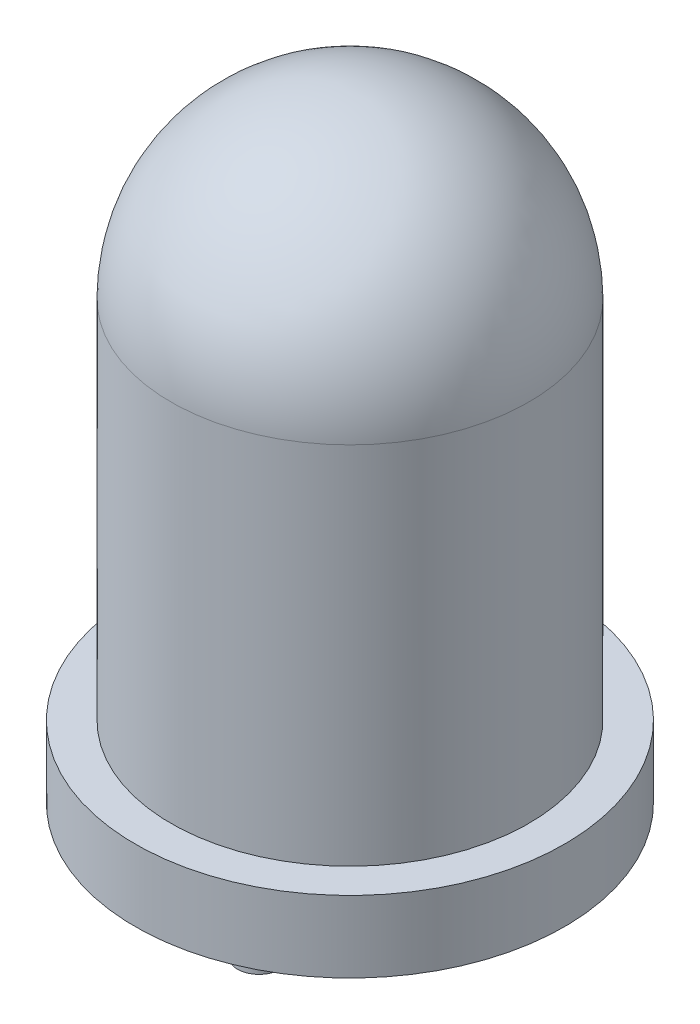
from build123d import *

# Parameters (mm, degrees)
ESQUISSE2_R        = 0.3
BOSS_EXTRU_1_DEPTH = 2.5
ESQUISSE3_R        = 0.3
BOSS_EXTRU_2_DEPTH = 1
BOSS_EXTRU_3_DEPTH = 0.25
ESQUISSE5_R        = 0.6
BOSS_EXTRU_4_DEPTH = 0.2


with BuildPart() as part:
    # Esquisse1 → Révolution1 (revolve)
    with BuildSketch(Plane.XY, mode=Mode.PRIVATE) as r_volution1_sk:
        with BuildLine():
            Line((-2.5, 6.1), (-2.5, 1))
            Line((-2.5, 1), (-3, 1))
            Line((-3, 1), (-3, 0))
            Line((-3, 0), (0, 0))
            Line((0, 0), (0, 0.5))
            Line((0, 0.5), (-2.2, 0.5))
            Line((-2.2, 0.5), (-2.2, 6.1))
            ThreePointArc((-2.2, 6.1), (-1.555634919, 7.655634919), (0, 8.3))
            Line((0, 8.3), (0, 8.6))
            ThreePointArc((0, 8.6), (-1.767766953, 7.867766953), (-2.5, 6.1))
        make_face()
    revolve(r_volution1_sk.sketch.rotate(Axis((0, 0, 0), (0, 1, 0)), 270), axis=Axis((0, 0, 0), (0, 1, 0)))

    # Esquisse2 → Boss.-Extru.1 (add)
    with BuildSketch(Plane.XZ):
        with Locations(Location((-1.27, 0, 0), (0, 0, 90))):
            Circle(ESQUISSE2_R)
    extrude(amount=BOSS_EXTRU_1_DEPTH)

    # Esquisse3 → Boss.-Extru.2 (add)
    with BuildSketch(Plane.XZ):
        with Locations(Location((1.27, 0, 0), (0, 0, 90))):
            Circle(ESQUISSE3_R)
    extrude(amount=BOSS_EXTRU_2_DEPTH)

    # Esquisse4 → Boss.-Extru.3 (add, symmetric)
    with BuildSketch(Plane.XY):
        Polygon((-1.12, 4.2), (-0.610441672, 2.8), (0.32, 2.8), (0.32, 2.2), (-0.92, 2.2), (-0.92, 0), (-1.62, 0), (-1.62, 4.2), align=None)
        Polygon((-0.694328891, 4.2), (1.62, 4.2), (1.62, 0), (0.92, 0), (0.92, 3.2), (-0.330358657, 3.2), align=None)
    extrude(amount=BOSS_EXTRU_3_DEPTH, both=True)

    # Esquisse5 → Boss.-Extru.4 (add)
    with BuildSketch(Plane(origin=(0, 4.2, 0), x_dir=(1, 0, 0), z_dir=(0, 1, 0))):
        Circle(ESQUISSE5_R)
    extrude(amount=-BOSS_EXTRU_4_DEPTH)


solid = part.part
